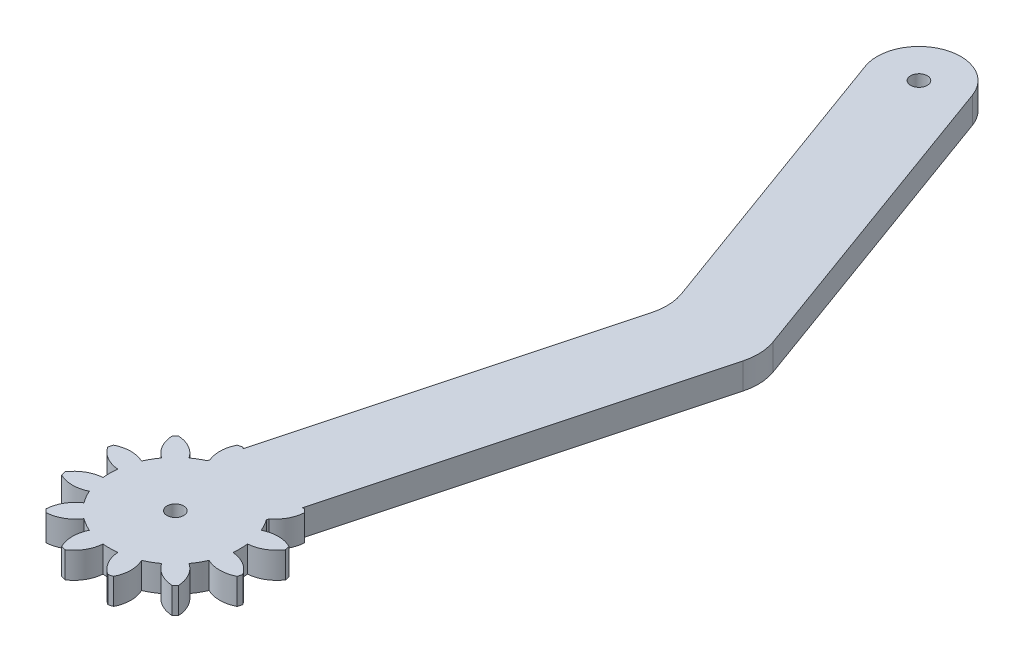
from build123d import *

# Parameters (mm, degrees)
BOSS_EXTRUDE1_DEPTH = 5
FILLET1_RADIUS      = 8
FILLET1_LENGTH      = 5
FILLET2_R           = 10
SKETCH2_R           = 1.6
CUT_EXTRUDE2_DEPTH  = 154.464821467
BOSS_EXTRUDE3_DEPTH = 5
SKETCH6_R           = 1.6
CUT_EXTRUDE3_DEPTH  = 154.464821467


with BuildPart() as part:
    # Sketch1 → Boss-Extrude1 (new body)
    with BuildSketch(Plane(origin=(0, 0, 0), x_dir=(1, 0, 0), z_dir=(0, 1, 0))):
        with BuildLine():
            Line((10.213282362, 7.206862244), (30.304817628, 82.189492661))
            Line((30.304817628, 82.189492661), (4.637991004, 152.70851924))
            Line((4.637991004, 152.70851924), (-10.397090929, 147.236196947))
            Line((-10.397090929, 147.236196947), (13.544319104, 81.457713492))
            Line((13.544319104, 81.457713492), (-5.241530859, 11.347966966))
            ThreePointArc((-5.241530859, 11.347966966), (-3.235238064, -12.074072829), (10.213282362, 7.206862244))
        make_face()
    extrude(amount=BOSS_EXTRUDE1_DEPTH)

    # Fillet1: full round fillet: the end face becomes a half cylinder, R = half its width
    fillet1_face = Plane((-2.879549962, 2.5, -149.972358093), x_dir=(0, 1, 0), z_dir=(-0.342020143326, 0, -0.939692620786))  # on the end face: x along it, z out of the body
    fillet1_slab = fillet1_face.offset(-FILLET1_RADIUS / 2) * Box(FILLET1_LENGTH, 2 * FILLET1_RADIUS, FILLET1_RADIUS, mode=Mode.PRIVATE)  # the body's end, R deep
    fillet1_round = Plane((-0.143388815, 2.5, -142.454817127), x_dir=(-0.342020143326, 0, -0.939692620786), z_dir=(0, 1, 0)) * Cylinder(FILLET1_RADIUS, FILLET1_LENGTH, mode=Mode.PRIVATE)  # its axis R under the face
    add(fillet1_slab - fillet1_round, mode=Mode.SUBTRACT)

    # Fillet2
    fillet2_edges = [part.edges().sort_by_distance(p)[0] for p in [
        (13.544319104, 2.5, -81.457713492),
        (30.304817628, 2.5, -82.189492661),
    ]]
    fillet(fillet2_edges, radius=FILLET2_R)

    # Sketch2 → Cut-Extrude2 (cut, through all)
    with BuildSketch(Plane(origin=(0, 5, 0), x_dir=(1, 0, 0), z_dir=(0, 1, 0))):
        with Locations(Location((-0.143388816, 142.454817127, 0), (0, 0, 270))):
            Circle(SKETCH2_R)
    extrude(amount=-CUT_EXTRUDE2_DEPTH, mode=Mode.SUBTRACT)

    # Sketch5 → Boss-Extrude3 (add)
    with BuildSketch(Plane(origin=(0, 5, 0), x_dir=(1, 0, 0), z_dir=(0, 1, 0))):
        with BuildLine():
            ThreePointArc((-12.051706508, -12.688828561), (-9.162245044, -11.749370601), (-7.103491322, -9.514845613))
            ThreePointArc((-7.103491322, -9.514845613), (-5.937, -10.283185645), (-4.688352353, -10.909226747))
            ThreePointArc((-4.688352353, -10.909226747), (-5.594130897, -13.809422264), (-4.962994624, -16.781498275))
            ThreePointArc((-4.962994624, -16.781498275), (-4.529333289, -16.90370196), (-4.092669715, -17.014701132))
            ThreePointArc((-4.092669715, -17.014701132), (-2.060051663, -14.756375941), (-1.394381134, -11.791843675))
            ThreePointArc((-1.394381134, -11.791843675), (0, -11.874), (1.394381134, -11.791843675))
            ThreePointArc((1.394381134, -11.791843675), (2.060051663, -14.756375941), (4.092669715, -17.014701132))
            ThreePointArc((4.092669715, -17.014701132), (4.529333289, -16.90370196), (4.962994624, -16.781498275))
            ThreePointArc((4.962994624, -16.781498275), (5.594130897, -13.809422264), (4.688352353, -10.909226747))
            ThreePointArc((4.688352353, -10.909226747), (5.937, -10.283185645), (7.103491322, -9.514845613))
            ThreePointArc((7.103491322, -9.514845613), (9.162245044, -11.749370601), (12.051706508, -12.688828561))
            ThreePointArc((12.051706508, -12.688828561), (12.374368671, -12.374368671), (12.688828561, -12.051706508))
            ThreePointArc((12.688828561, -12.051706508), (11.749370601, -9.162245044), (9.514845613, -7.103491322))
            ThreePointArc((9.514845613, -7.103491322), (10.283185645, -5.937), (10.909226747, -4.688352353))
            ThreePointArc((10.909226747, -4.688352353), (13.809422264, -5.594130897), (16.781498275, -4.962994624))
            ThreePointArc((16.781498275, -4.962994624), (16.90370196, -4.529333289), (17.014701132, -4.092669715))
            ThreePointArc((17.014701132, -4.092669715), (14.756375941, -2.060051663), (11.791843675, -1.394381134))
            ThreePointArc((11.791843675, -1.394381134), (11.874, 0), (11.791843675, 1.394381134))
            ThreePointArc((11.791843675, 1.394381134), (14.756375941, 2.060051663), (17.014701132, 4.092669715))
            ThreePointArc((17.014701132, 4.092669715), (16.90370196, 4.529333289), (16.781498275, 4.962994624))
            ThreePointArc((16.781498275, 4.962994624), (13.809422264, 5.594130897), (10.909226747, 4.688352353))
            ThreePointArc((10.909226747, 4.688352353), (10.283185645, 5.937), (9.514845613, 7.103491322))
            ThreePointArc((9.514845613, 7.103491322), (11.749370601, 9.162245044), (12.688828561, 12.051706508))
            ThreePointArc((12.688828561, 12.051706508), (12.374368671, 12.374368671), (12.051706508, 12.688828561))
            ThreePointArc((12.051706508, 12.688828561), (9.162245044, 11.749370601), (7.103491322, 9.514845613))
            ThreePointArc((7.103491322, 9.514845613), (5.937, 10.283185645), (4.688352353, 10.909226747))
            ThreePointArc((4.688352353, 10.909226747), (5.594130897, 13.809422264), (4.962994624, 16.781498275))
            ThreePointArc((4.962994624, 16.781498275), (4.529333289, 16.90370196), (4.092669715, 17.014701132))
            ThreePointArc((4.092669715, 17.014701132), (2.060051663, 14.756375941), (1.394381134, 11.791843675))
            ThreePointArc((1.394381134, 11.791843675), (0, 11.874), (-1.394381134, 11.791843675))
            ThreePointArc((-1.394381134, 11.791843675), (-2.060051663, 14.756375941), (-4.092669715, 17.014701132))
            ThreePointArc((-4.092669715, 17.014701132), (-4.529333289, 16.90370196), (-4.962994624, 16.781498275))
            ThreePointArc((-4.962994624, 16.781498275), (-5.594130897, 13.809422264), (-4.688352353, 10.909226747))
            ThreePointArc((-4.688352353, 10.909226747), (-5.937, 10.283185645), (-7.103491322, 9.514845613))
            ThreePointArc((-7.103491322, 9.514845613), (-9.162245044, 11.749370601), (-12.051706508, 12.688828561))
            ThreePointArc((-12.051706508, 12.688828561), (-12.374368671, 12.374368671), (-12.688828561, 12.051706508))
            ThreePointArc((-12.688828561, 12.051706508), (-11.749370601, 9.162245044), (-9.514845613, 7.103491322))
            ThreePointArc((-9.514845613, 7.103491322), (-10.283185645, 5.937), (-10.909226747, 4.688352353))
            ThreePointArc((-10.909226747, 4.688352353), (-13.809422264, 5.594130897), (-16.781498275, 4.962994624))
            ThreePointArc((-16.781498275, 4.962994624), (-16.90370196, 4.529333289), (-17.014701132, 4.092669715))
            ThreePointArc((-17.014701132, 4.092669715), (-14.756375941, 2.060051663), (-11.791843675, 1.394381134))
            ThreePointArc((-11.791843675, 1.394381134), (-11.874, 0), (-11.791843675, -1.394381134))
            ThreePointArc((-11.791843675, -1.394381134), (-14.756375941, -2.060051663), (-17.014701132, -4.092669715))
            ThreePointArc((-17.014701132, -4.092669715), (-16.90370196, -4.529333289), (-16.781498275, -4.962994624))
            ThreePointArc((-16.781498275, -4.962994624), (-13.809422264, -5.594130897), (-10.909226747, -4.688352353))
            ThreePointArc((-10.909226747, -4.688352353), (-10.283185645, -5.937), (-9.514845613, -7.103491322))
            ThreePointArc((-9.514845613, -7.103491322), (-11.749370601, -9.162245044), (-12.688828561, -12.051706508))
            ThreePointArc((-12.688828561, -12.051706508), (-12.374368671, -12.374368671), (-12.051706508, -12.688828561))
        make_face()
    extrude(amount=-BOSS_EXTRUDE3_DEPTH)

    # Sketch6 → Cut-Extrude3 (cut, through all)
    with BuildSketch(Plane(origin=(0, 5, 0), x_dir=(1, 0, 0), z_dir=(0, 1, 0))):
        with Locations(Location((0, 0, 0), (0, 0, 270))):
            Circle(SKETCH6_R)
    extrude(amount=-CUT_EXTRUDE3_DEPTH, mode=Mode.SUBTRACT)


solid = part.part
